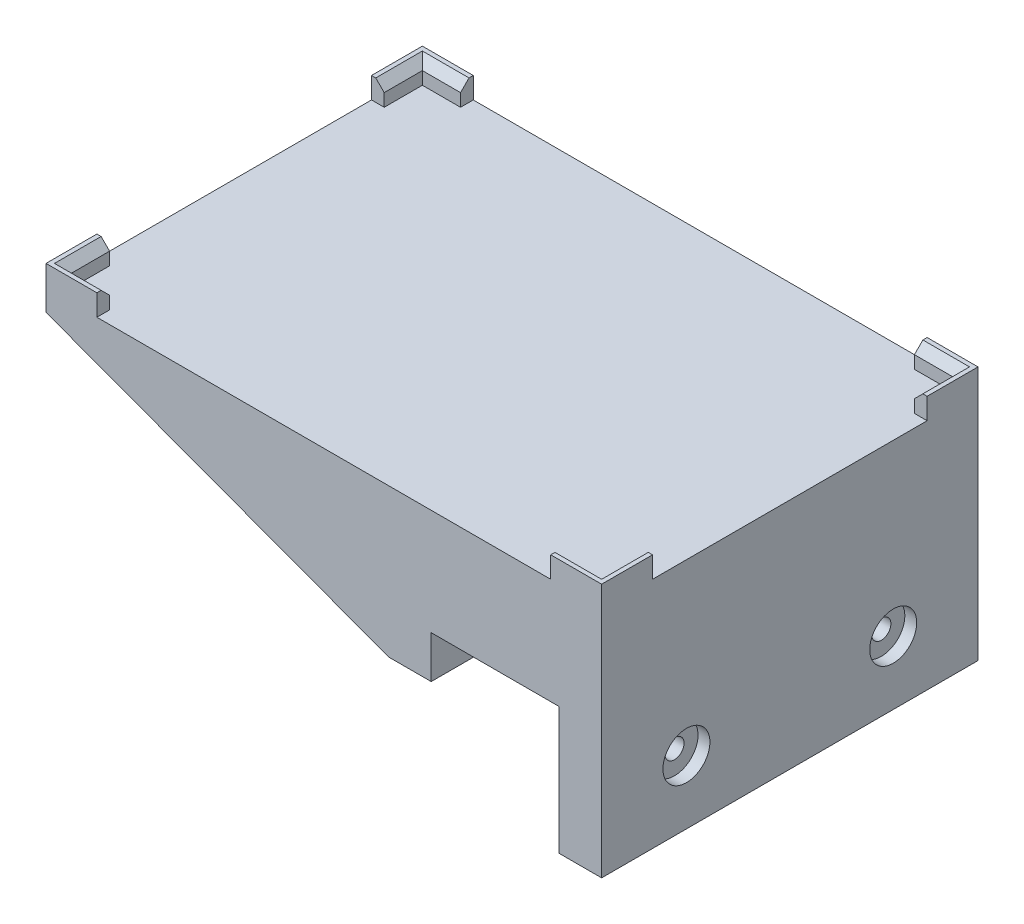
from build123d import *

# Parameters (mm, degrees)
SKETCH1_W                                    = 131.06
SKETCH1_H                                    = 88.78
BOSS_EXTRUDE1_DEPTH                          = 5
SKETCH2_W                                    = 131.06
SKETCH2_H                                    = 88.78
SKETCH2_W_2                                  = 125.06
SKETCH2_H_2                                  = 82.78
BOSS_EXTRUDE2_DEPTH                          = 5
CHAMFER1_SIZE                                = 2
CUT_EXTRUDE1_DEPTH                           = 80.307332574
BOSS_EXTRUDE3_START                          = -44.39
BOSS_EXTRUDE3_DEPTH                          = 88.78
BOSS_EXTRUDE4_DEPTH                          = 5
CBORE_FOR_M4_HEX_HEAD_CAP_SCREW1_D           = 4.5
CBORE_FOR_M4_HEX_HEAD_CAP_SCREW1_CBORE_D     = 11.083
CBORE_FOR_M4_HEX_HEAD_CAP_SCREW1_CBORE_DEPTH = 2.8


with BuildPart() as part:
    # Sketch1 → Boss-Extrude1 (new body)
    with BuildSketch(Plane(origin=(0, 0, 0), x_dir=(1, 0, 0), z_dir=(0, 1, 0))):
        Rectangle(SKETCH1_W, SKETCH1_H)
    extrude(amount=BOSS_EXTRUDE1_DEPTH)

    # Sketch2 → Boss-Extrude2 (add)
    with BuildSketch(Plane(origin=(0, 5, 0), x_dir=(1, 0, 0), z_dir=(0, 1, 0))):
        Rectangle(SKETCH2_W, SKETCH2_H)
        Rectangle(SKETCH2_W_2, SKETCH2_H_2, mode=Mode.SUBTRACT)
    extrude(amount=BOSS_EXTRUDE2_DEPTH)

    # Chamfer1
    chamfer1_edges = [part.edges().sort_by_distance(p)[0] for p in [
        (62.53, 10, 0),
        (0, 10, -41.39),
        (-62.53, 10, 0),
        (0, 10, 41.39),
    ]]
    chamfer(chamfer1_edges, length=CHAMFER1_SIZE)

    # Sketch3 → Cut-Extrude1 (cut, through all)
    with BuildSketch(Plane(origin=(0, 5, 0), x_dir=(1, 0, 0), z_dir=(0, 1, 0))):
        Polygon((-65.53, 32.39), (-65.53, -32.39), (-53.53, -32.39), (-53.53, -44.39), (53.53, -44.39), (53.53, -32.39), (65.53, -32.39), (65.53, 32.39), (53.53, 32.39), (53.53, 44.39), (-53.53, 44.39), (-53.53, 32.39), align=None)
    extrude(amount=CUT_EXTRUDE1_DEPTH, mode=Mode.SUBTRACT)

    # Sketch4 → Boss-Extrude3 (add)
    with BuildSketch(Plane.XY.offset(BOSS_EXTRUDE3_START)):
        Polygon((65.53, 0), (65.53, -50), (55.53, -50), (55.53, -20), (25.33, -20), (25.33, -30), (15.33, -30), (15.33, 0), align=None)
    extrude(amount=BOSS_EXTRUDE3_DEPTH)

    # Sketch5 → Boss-Extrude4 (add)
    with BuildSketch(Plane.XY.offset(44.39)):
        Polygon((-65.53, 0), (15.33, -30), (15.33, 0), align=None)
    boss_extrude4 = extrude(amount=-BOSS_EXTRUDE4_DEPTH)

    # Mirror1: Boss-Extrude4 across plane
    add(boss_extrude4.mirror(Plane.XY))

    # CBORE for M4 Hex Head Cap Screw1 (through all)
    with Locations(Plane(origin=(65.53, 0, 0), x_dir=(0, 0, -1), z_dir=(1, 0, 0))):
        with Locations((-24.39, -35), (24.39, -35)):
            CounterBoreHole(CBORE_FOR_M4_HEX_HEAD_CAP_SCREW1_D / 2, CBORE_FOR_M4_HEX_HEAD_CAP_SCREW1_CBORE_D / 2, CBORE_FOR_M4_HEX_HEAD_CAP_SCREW1_CBORE_DEPTH)


solid = part.part
